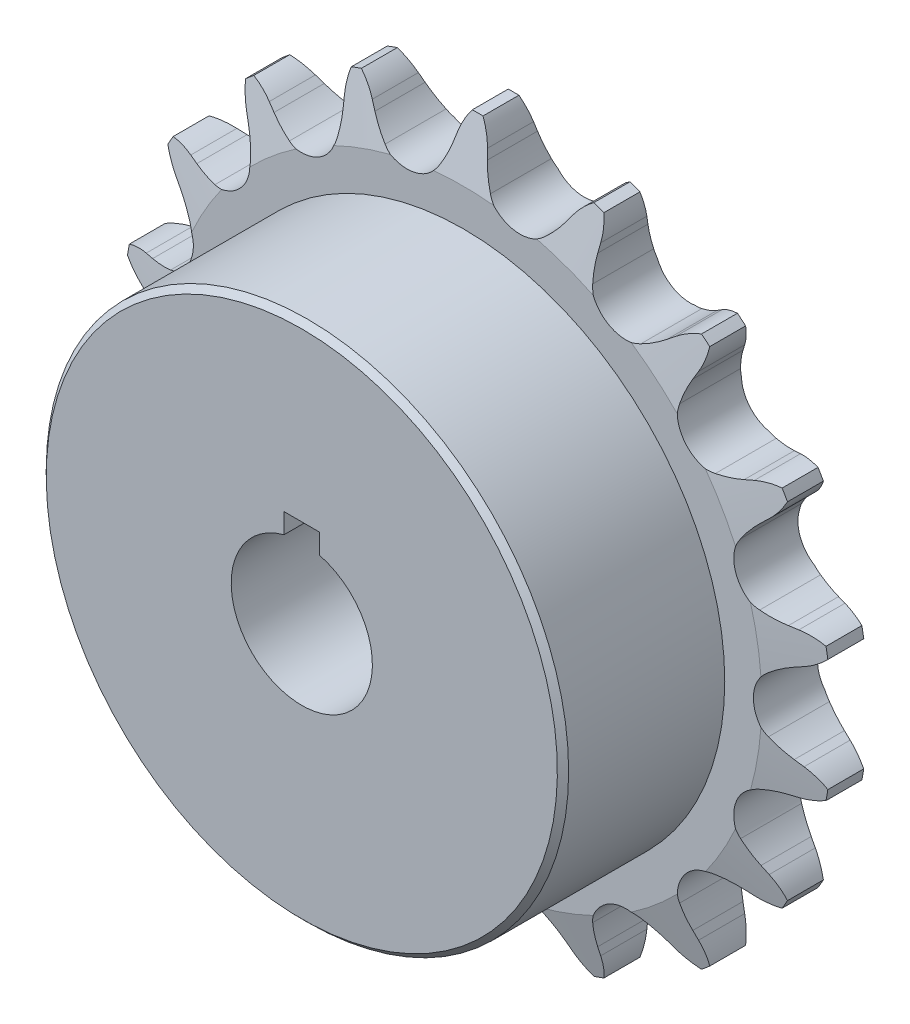
from build123d import *

# Parameters (mm, degrees)
CUT_EXTRUDE1_DEPTH      = 57.511226975
CIRPATTERN1_COUNT       = 18
BOSS_EXTRUDE1_START     = 3.6068
SKETCH3_R               = 29.36875
BOSS_EXTRUDE1_DEPTH     = 18.1864
CUT_EXTRUDE2_DEPTH      = 61.127843216
CUT_EXTRUDE2_DEPTH_BACK = 61.127843216
SKETCH4_R               = 7.9375
SKETCH5_W               = 5.4102
SKETCH5_H               = 10.230360445
CUT_EXTRUDE3_DEPTH      = 62.527018159


with BuildPart() as part:
    # Sketch1 → Revolve1 (revolve)
    with BuildSketch(Plane(origin=(0, 0, 0), x_dir=(0, 0, -1), z_dir=(1, 0, 0)), mode=Mode.PRIVATE) as revolve1_sk:
        Polygon((3.6068, 0), (-3.6068, 0), (-3.6068, 33.528), (-2.0193, 39.878), (2.0193, 39.878), (3.6068, 33.528), align=None)
    revolve(revolve1_sk.sketch.rotate(Axis((0, 0, -3.6068), (0, 0, 1)), 90), axis=Axis((0, 0, -3.6068), (0, 0, 1)))

    # Sketch2 → Cut-Extrude1 (cut, symmetric)
    with BuildSketch(Plane.XY):
        with BuildLine():
            Line((11.273363586, -35.852222703), (10.749485066, -35.059058687))
            ThreePointArc((10.749485066, -35.059058687), (9.939703817, -33.990921491), (8.998355267, -33.036706814))
            ThreePointArc((8.998355267, -33.036706814), (5.658235671, -32.089449091), (2.843531156, -34.121968366))
            ThreePointArc((2.843531156, -34.121968366), (2.285313511, -35.340597023), (1.889692483, -36.621279163))
            Line((1.889692483, -36.621279163), (1.668685774, -37.545786542))
            ThreePointArc((1.668685774, -37.545786542), (-1.007403995, -41.445390458), (-5.60606067, -42.550254223))
            ThreePointArc((-5.60606067, -42.550254223), (7.452627081, -42.265948473), (19.821017891, -38.066774232))
            ThreePointArc((19.821017891, -38.066774232), (15.121808485, -38.601375121), (11.273363586, -35.852222703))
        make_face()
    cut_extrude1 = extrude(amount=CUT_EXTRUDE1_DEPTH, both=True, mode=Mode.SUBTRACT)

    # CirPattern1: Cut-Extrude1 ×18 about axis
    cirpattern1_axis = Axis((0, 0, 0), (0, 0, 1))
    for i in range(1, CIRPATTERN1_COUNT):
        add(cut_extrude1.rotate(cirpattern1_axis, i * 360 / CIRPATTERN1_COUNT), mode=Mode.SUBTRACT)

    # Sketch3 → Boss-Extrude1 (add)
    with BuildSketch(Plane.XY.offset(BOSS_EXTRUDE1_START)):
        Circle(SKETCH3_R)
    extrude(amount=BOSS_EXTRUDE1_DEPTH)

    # Sketch4 → Cut-Extrude2 (cut, two sides: drawn at the far end of the back side and taken through both)
    with BuildSketch(Plane.XY.offset(-CUT_EXTRUDE2_DEPTH_BACK)):
        Circle(SKETCH4_R)
    extrude(amount=CUT_EXTRUDE2_DEPTH + CUT_EXTRUDE2_DEPTH_BACK, mode=Mode.SUBTRACT)

    # Sketch5 → Cut-Revolve1 (revolve, cut)
    with BuildSketch(Plane(origin=(0, 0, 0), x_dir=(0, 0, -1), z_dir=(1, 0, 0))):
        Polygon((-21.7932, 29.36875), (-21.7932, 28.73375), (-21.1582, 29.36875), align=None)
        with Locations((-6.3119, 34.762819777)):
            Rectangle(SKETCH5_W, SKETCH5_H)
    revolve(axis=Axis((0, 0, -3.6068), (0, 0, 1)), mode=Mode.SUBTRACT)

    # Sketch6 → Cut-Extrude3 (cut, through all)
    with BuildSketch(Plane(origin=(0, 0, -3.6068), x_dir=(-1, 0, 0), z_dir=(0, 0, -1))):
        with BuildLine():
            Line((-2, 7.681400019), (-2, 9.9375))
            Line((-2, 9.9375), (2, 9.9375))
            Line((2, 9.9375), (2, 7.681400019))
            ThreePointArc((2, 7.681400019), (0, 7.9375), (-2, 7.681400019))
        make_face()
    extrude(amount=-CUT_EXTRUDE3_DEPTH, mode=Mode.SUBTRACT)


solid = part.part
